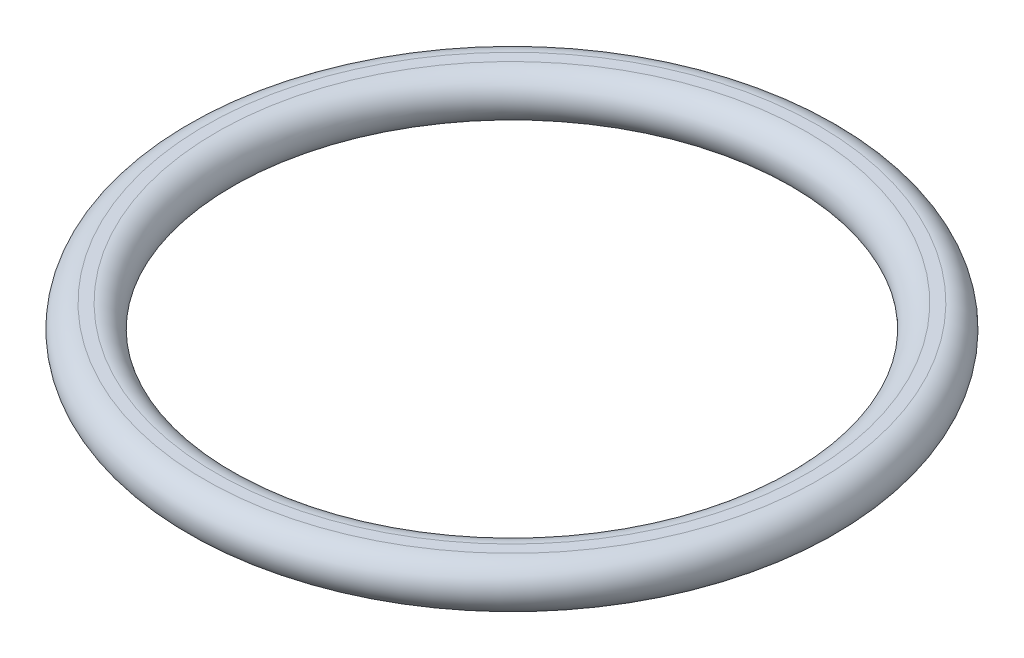
from build123d import *


with BuildPart() as part:
    # Sketch1 → Revolve1 (revolve)
    with BuildSketch(Plane.XY, mode=Mode.PRIVATE) as revolve1_sk:
        with BuildLine():
            Line((20.6375, 1.5875), (21.43125, 1.5875))
            ThreePointArc((21.43125, 1.5875), (23.01875, 0), (21.43125, -1.5875))
            Line((21.43125, -1.5875), (20.6375, -1.5875))
            ThreePointArc((20.6375, -1.5875), (19.05, 0), (20.6375, 1.5875))
        make_face()
    revolve(revolve1_sk.sketch.rotate(Axis((0, 0, 0), (0, 1, 0)), 90), axis=Axis((0, 0, 0), (0, 1, 0)))


solid = part.part
